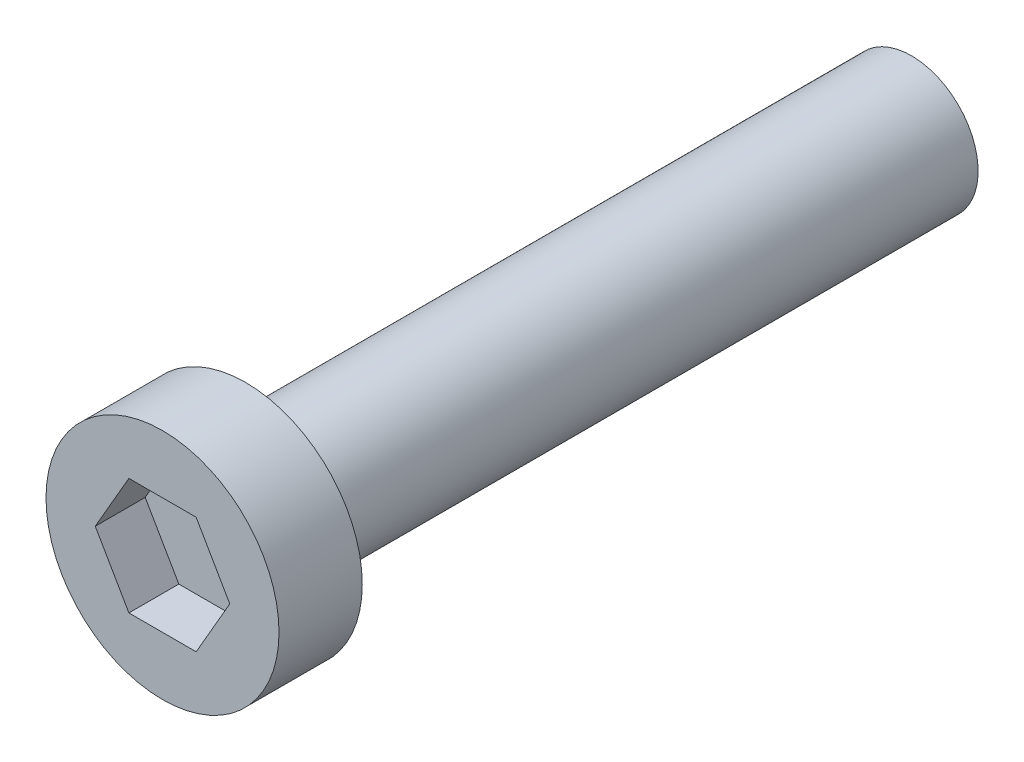
from build123d import *

# Parameters (mm, degrees)
SKETCH_1_R      = 3.5
EXTRUDE_1_DEPTH = 2.5
SKETCH_2_R      = 2
EXTRUDE_2_DEPTH = 20
EXTRUDE_3_DEPTH = 1


with BuildPart() as part:
    # 草图1 → 凸台-拉伸1 (new body)
    with BuildSketch(Plane.XY):
        Circle(SKETCH_1_R)
        Polygon((2.020725942, 0), (1.010362971, 1.75), (-1.010362971, 1.75), (-2.020725942, 0), (-1.010362971, -1.75), (1.010362971, -1.75), align=None, mode=Mode.SUBTRACT)
    extrude(amount=EXTRUDE_1_DEPTH)

    # 草图2 → 凸台-拉伸2 (add)
    with BuildSketch(Plane(origin=(0, 0, 0), x_dir=(-1, 0, 0), z_dir=(0, 0, -1))):
        with Locations(Location((0, 0, 0), (0, 0, 178.955024372))):
            Circle(SKETCH_2_R)
    extrude(amount=EXTRUDE_2_DEPTH)

    # 草图1<3> → 凸台-拉伸3 (add)
    with BuildSketch(Plane.XY):
        Polygon((-1.010362971, -1.75), (1.010362971, -1.75), (2.020725942, 0), (1.010362971, 1.75), (-1.010362971, 1.75), (-2.020725942, 0), align=None)
    extrude(amount=EXTRUDE_3_DEPTH)


solid = part.part
